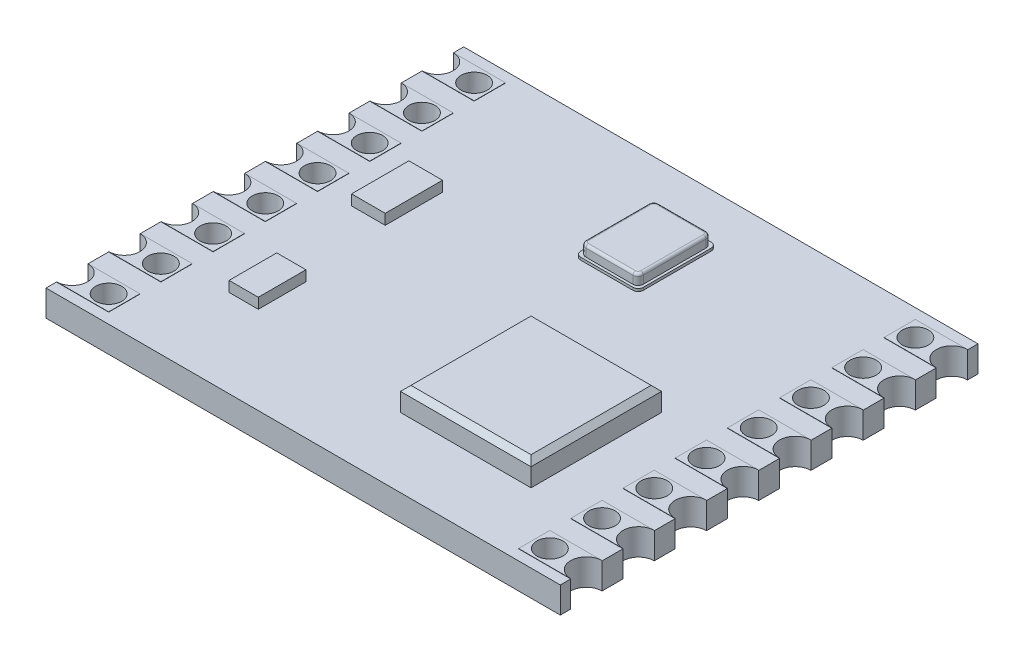
from build123d import *

# Parameters (mm, degrees)
SKETCH1_W           = 19.7
SKETCH1_H           = 16
BOSS_EXTRUDE1_DEPTH = 1
SKETCH2_W           = 2
SKETCH2_H           = 1.2
BOSS_EXTRUDE2_DEPTH = 0.01
SKETCH3_R           = 0.5
CUT_EXTRUDE1_DEPTH  = 1.01
SKETCH4_W           = 5
SKETCH4_H           = 5
BOSS_EXTRUDE3_DEPTH = 0.9
SKETCH5_W           = 1.118442439
SKETCH5_H           = 1.825254878
SKETCH5_W_2         = 1.288131099
SKETCH5_H_2         = 2.193633861
BOSS_EXTRUDE4_DEPTH = 0.4
BOSS_EXTRUDE5_DEPTH = 0.1
BOSS_EXTRUDE6_DEPTH = 0.4
FILLET1_R           = 0.1
CHAMFER1_SIZE       = 0.2


with BuildPart() as part:
    # Sketch1 → Boss-Extrude1 (new body)
    with BuildSketch(Plane(origin=(0, 0, 0), x_dir=(1, 0, 0), z_dir=(0, 1, 0))):
        with Locations((9.85, 8)):
            Rectangle(SKETCH1_W, SKETCH1_H)
    extrude(amount=BOSS_EXTRUDE1_DEPTH)

    # Sketch2 → Boss-Extrude2 (add)
    with BuildSketch(Plane(origin=(0, 1, 0), x_dir=(1, 0, 0), z_dir=(0, 1, 0))):
        with Locations((1, 15)):
            Rectangle(SKETCH2_W, SKETCH2_H)
        with Locations((1, 13)):
            Rectangle(SKETCH2_W, SKETCH2_H)
        with Locations((1, 11)):
            Rectangle(SKETCH2_W, SKETCH2_H)
        with Locations((1, 9)):
            Rectangle(SKETCH2_W, SKETCH2_H)
        with Locations((1, 7)):
            Rectangle(SKETCH2_W, SKETCH2_H)
        with Locations((1, 5)):
            Rectangle(SKETCH2_W, SKETCH2_H)
        with Locations((1, 3)):
            Rectangle(SKETCH2_W, SKETCH2_H)
        with Locations((1, 1)):
            Rectangle(SKETCH2_W, SKETCH2_H)
        with Locations((18.7, 15)):
            Rectangle(SKETCH2_W, SKETCH2_H)
        with Locations((18.7, 13)):
            Rectangle(SKETCH2_W, SKETCH2_H)
        with Locations((18.7, 11)):
            Rectangle(SKETCH2_W, SKETCH2_H)
        with Locations((18.7, 9)):
            Rectangle(SKETCH2_W, SKETCH2_H)
        with Locations((18.7, 7)):
            Rectangle(SKETCH2_W, SKETCH2_H)
        with Locations((18.7, 5)):
            Rectangle(SKETCH2_W, SKETCH2_H)
        with Locations((18.7, 3)):
            Rectangle(SKETCH2_W, SKETCH2_H)
        with Locations((18.7, 1)):
            Rectangle(SKETCH2_W, SKETCH2_H)
    extrude(amount=BOSS_EXTRUDE2_DEPTH)

    # Sketch3 → Cut-Extrude1 (cut)
    with BuildSketch(Plane(origin=(0, 1.01, 0), x_dir=(1, 0, 0), z_dir=(0, 1, 0))):
        with Locations(Location((1.4, 15, 0), (0, 0, 270))):
            Circle(SKETCH3_R)
        with Locations(Location((1.4, 13, 0), (0, 0, 270))):
            Circle(SKETCH3_R)
        with Locations(Location((1.4, 11, 0), (0, 0, 270))):
            Circle(SKETCH3_R)
        with Locations(Location((1.4, 9, 0), (0, 0, 270))):
            Circle(SKETCH3_R)
        with Locations(Location((1.4, 7, 0), (0, 0, 270))):
            Circle(SKETCH3_R)
        with Locations(Location((1.4, 5, 0), (0, 0, 270))):
            Circle(SKETCH3_R)
        with Locations(Location((1.4, 3, 0), (0, 0, 270))):
            Circle(SKETCH3_R)
        with Locations(Location((1.4, 1, 0), (0, 0, 270))):
            Circle(SKETCH3_R)
        with Locations(Location((18.3, 15, 0), (0, 0, 270))):
            Circle(SKETCH3_R)
        with Locations(Location((18.3, 13, 0), (0, 0, 270))):
            Circle(SKETCH3_R)
        with Locations(Location((18.3, 11, 0), (0, 0, 270))):
            Circle(SKETCH3_R)
        with Locations(Location((18.3, 9, 0), (0, 0, 270))):
            Circle(SKETCH3_R)
        with Locations(Location((18.3, 7, 0), (0, 0, 270))):
            Circle(SKETCH3_R)
        with Locations(Location((18.3, 5, 0), (0, 0, 270))):
            Circle(SKETCH3_R)
        with Locations(Location((18.3, 3, 0), (0, 0, 270))):
            Circle(SKETCH3_R)
        with Locations(Location((18.3, 1, 0), (0, 0, 270))):
            Circle(SKETCH3_R)
        with BuildLine():
            Line((0, 15.6), (0, 14.4))
            ThreePointArc((0, 14.4), (0.6, 15), (0, 15.6))
        make_face()
        with BuildLine():
            Line((0, 13.6), (0, 12.4))
            ThreePointArc((0, 12.4), (0.6, 13), (0, 13.6))
        make_face()
        with BuildLine():
            Line((0, 11.6), (0, 10.4))
            ThreePointArc((0, 10.4), (0.6, 11), (0, 11.6))
        make_face()
        with BuildLine():
            Line((0, 9.6), (0, 8.4))
            ThreePointArc((0, 8.4), (0.6, 9), (0, 9.6))
        make_face()
        with BuildLine():
            Line((0, 7.6), (0, 6.4))
            ThreePointArc((0, 6.4), (0.6, 7), (0, 7.6))
        make_face()
        with BuildLine():
            Line((0, 5.6), (0, 4.4))
            ThreePointArc((0, 4.4), (0.6, 5), (0, 5.6))
        make_face()
        with BuildLine():
            Line((0, 3.6), (0, 2.4))
            ThreePointArc((0, 2.4), (0.6, 3), (0, 3.6))
        make_face()
        with BuildLine():
            Line((0, 1.6), (0, 0.4))
            ThreePointArc((0, 0.4), (0.6, 1), (0, 1.6))
        make_face()
        with BuildLine():
            Line((19.7, 15.6), (19.7, 14.4))
            ThreePointArc((19.7, 14.4), (19.1, 15), (19.7, 15.6))
        make_face()
        with BuildLine():
            Line((19.7, 13.6), (19.7, 12.4))
            ThreePointArc((19.7, 12.4), (19.1, 13), (19.7, 13.6))
        make_face()
        with BuildLine():
            Line((19.7, 11.6), (19.7, 10.4))
            ThreePointArc((19.7, 10.4), (19.1, 11), (19.7, 11.6))
        make_face()
        with BuildLine():
            Line((19.7, 9.6), (19.7, 8.4))
            ThreePointArc((19.7, 8.4), (19.1, 9), (19.7, 9.6))
        make_face()
        with BuildLine():
            Line((19.7, 7.6), (19.7, 6.4))
            ThreePointArc((19.7, 6.4), (19.1, 7), (19.7, 7.6))
        make_face()
        with BuildLine():
            Line((19.7, 5.6), (19.7, 4.4))
            ThreePointArc((19.7, 4.4), (19.1, 5), (19.7, 5.6))
        make_face()
        with BuildLine():
            Line((19.7, 3.6), (19.7, 2.4))
            ThreePointArc((19.7, 2.4), (19.1, 3), (19.7, 3.6))
        make_face()
        with BuildLine():
            Line((19.7, 1.6), (19.7, 0.4))
            ThreePointArc((19.7, 0.4), (19.1, 1), (19.7, 1.6))
        make_face()
    extrude(amount=-CUT_EXTRUDE1_DEPTH, mode=Mode.SUBTRACT)

    # Sketch4 → Boss-Extrude3 (add)
    with BuildSketch(Plane(origin=(0, 1, 0), x_dir=(1, 0, 0), z_dir=(0, 1, 0))):
        with Locations((13.417484737, 5.161104769)):
            Rectangle(SKETCH4_W, SKETCH4_H)
    extrude(amount=BOSS_EXTRUDE3_DEPTH)

    # Sketch5 → Boss-Extrude4 (add)
    with BuildSketch(Plane(origin=(0, 1, 0), x_dir=(1, 0, 0), z_dir=(0, 1, 0))):
        with Locations((4.211907739, 4.273374336)):
            Rectangle(SKETCH5_W, SKETCH5_H)
        with Locations((3.772536097, 9.673616078)):
            Rectangle(SKETCH5_W_2, SKETCH5_H_2)
    extrude(amount=BOSS_EXTRUDE4_DEPTH)

    # Sketch6 → Boss-Extrude5 (add)
    with BuildSketch(Plane(origin=(0, 1, 0), x_dir=(1, 0, 0), z_dir=(0, 1, 0))):
        with BuildLine():
            Line((9.314947629, 14.164496182), (11.314947629, 14.164496182))
            ThreePointArc((11.314947629, 14.164496182), (11.456368986, 14.105917538), (11.514947629, 13.964496182))
            Line((11.514947629, 13.964496182), (11.514947629, 11.364496182))
            ThreePointArc((11.514947629, 11.364496182), (11.456368986, 11.223074825), (11.314947629, 11.164496182))
            Line((11.314947629, 11.164496182), (9.314947629, 11.164496182))
            ThreePointArc((9.314947629, 11.164496182), (9.173526273, 11.223074825), (9.114947629, 11.364496182))
            Line((9.114947629, 11.364496182), (9.114947629, 13.964496182))
            ThreePointArc((9.114947629, 13.964496182), (9.173526273, 14.105917538), (9.314947629, 14.164496182))
        make_face()
    extrude(amount=BOSS_EXTRUDE5_DEPTH)

    # Sketch7 → Boss-Extrude6 (add)
    with BuildSketch(Plane(origin=(0, 1.1, 0), x_dir=(1, 0, 0), z_dir=(0, 1, 0))):
        with BuildLine():
            Line((9.414947629, 14.064496182), (11.214947629, 14.064496182))
            ThreePointArc((11.214947629, 14.064496182), (11.356368986, 14.005917538), (11.414947629, 13.864496182))
            Line((11.414947629, 13.864496182), (11.414947629, 11.464496182))
            ThreePointArc((11.414947629, 11.464496182), (11.356368986, 11.323074825), (11.214947629, 11.264496182))
            Line((11.214947629, 11.264496182), (9.414947629, 11.264496182))
            ThreePointArc((9.414947629, 11.264496182), (9.273526273, 11.323074825), (9.214947629, 11.464496182))
            Line((9.214947629, 11.464496182), (9.214947629, 13.864496182))
            ThreePointArc((9.214947629, 13.864496182), (9.273526273, 14.005917538), (9.414947629, 14.064496182))
        make_face()
    extrude(amount=BOSS_EXTRUDE6_DEPTH)

    # Fillet1
    fillet1_edges = [part.edges().sort_by_distance(p)[0] for p in [
        (11.356368986, 1.5, -14.005917538),
        (10.314947629, 1.5, -14.064496182),
        (9.273526273, 1.5, -14.005917538),
        (9.214947629, 1.5, -12.664496182),
        (9.273526273, 1.5, -11.323074825),
        (10.314947629, 1.5, -11.264496182),
        (11.356368986, 1.5, -11.323074825),
        (11.414947629, 1.5, -12.664496182),
    ]]
    fillet(fillet1_edges, radius=FILLET1_R)

    # Chamfer1
    chamfer1_edges = [part.edges().sort_by_distance(p)[0] for p in [
        (10.917484737, 1.9, -5.161104769),
        (13.417484737, 1.9, -2.661104769),
        (15.917484737, 1.9, -5.161104769),
        (13.417484737, 1.9, -7.661104769),
    ]]
    chamfer(chamfer1_edges, length=CHAMFER1_SIZE)


solid = part.part
